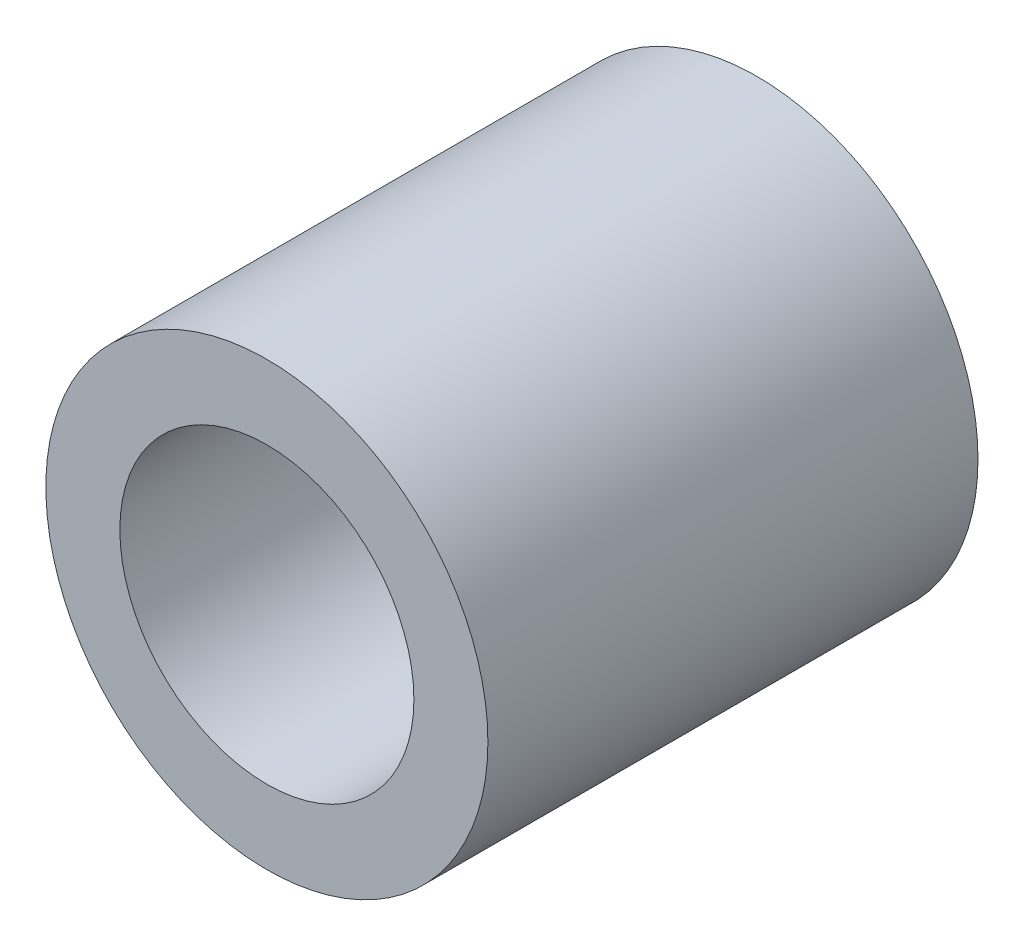
from build123d import *

# Parameters (mm, degrees)
SKETCH1_R      = 4.51
SKETCH1_R_2    = 3
EXTRUDE1_DEPTH = 5


with BuildPart() as part:
    # Sketch1 → Extrude1 (new, symmetric)
    with BuildSketch(Plane.XY):
        Circle(SKETCH1_R)
        Circle(SKETCH1_R_2, mode=Mode.SUBTRACT)
    extrude(amount=EXTRUDE1_DEPTH, both=True)


solid = part.part
